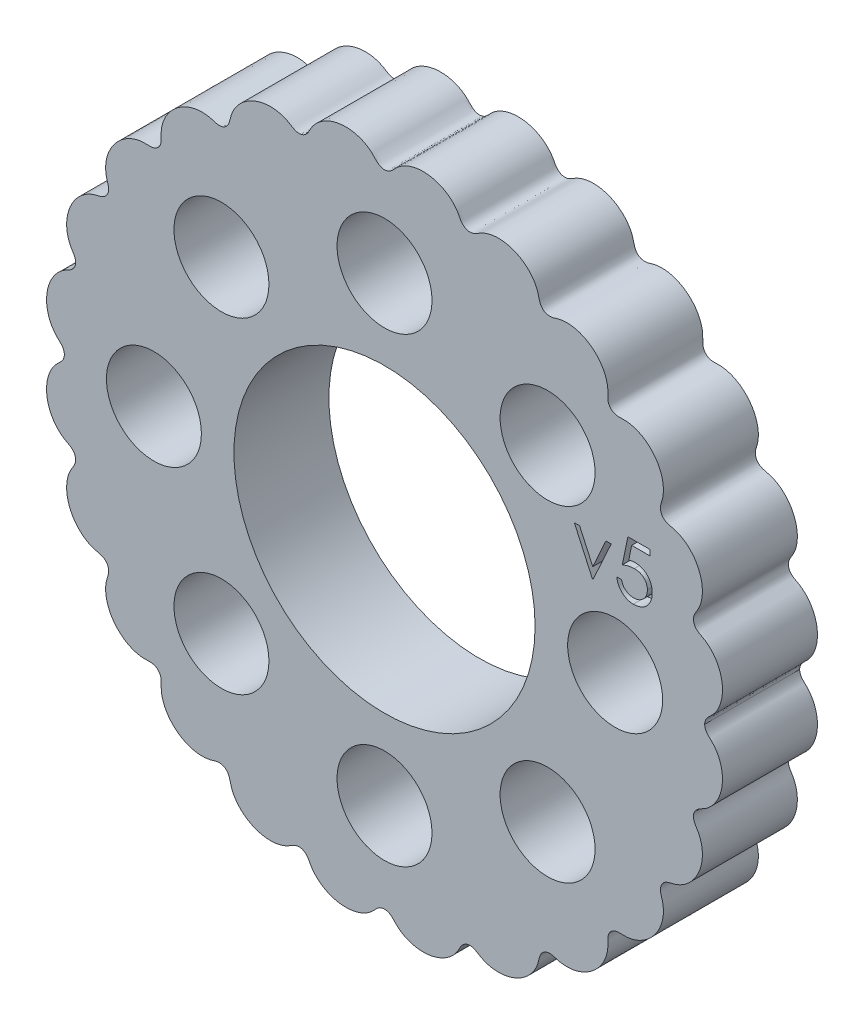
from build123d import *

# Parameters (mm, degrees)
BOSS_EXTRU_1_DEPTH      = 7
ESQUISSE2_R             = 11.1
ESQUISSE2_R_2           = 3.5
ENL_V_MAT_EXTRU_1_DEPTH = 36.920734554
VERSION_TEXT_DEPTH      = 1


with BuildPart() as part:
    # Esquisse1 → Boss.-Extru.1 (new body)
    with BuildSketch(Plane.XY):
        with BuildLine():
            add(Edge.make_bspline(
                [(23.6, 0), (23.6, 0.141263317), (23.694957489, 0.436529968), (23.984105148, 0.699966416), (24.214098656, 0.92210788), (24.485922993, 1.265914284), (24.738195558, 1.753151116), (24.902804155, 2.39533748), (24.929061691, 3.058471588), (24.820146126, 3.713569854), (24.57955061, 4.33187121), (24.214467979, 4.883674944), (23.809838813, 5.256722709), (23.444567676, 5.486205657), (23.121830867, 5.632182108), (22.805829464, 5.950444407), (22.734313606, 6.404992853), (22.914932417, 6.792042139), (23.100388311, 7.061569454), (23.241322807, 7.357836955), (23.379653116, 7.771179165), (23.455167998, 8.317175234), (23.400481311, 8.977844215), (23.210210839, 9.613984821), (22.894930523, 10.198352072), (22.466428325, 10.704182585), (22.026991864, 11.036841208), (21.636830993, 11.231351768), (21.327761788, 11.341047304), (21.006646284, 11.400550336), (20.604652425, 11.546398108), (20.33360552, 11.919233538), (20.332098964, 12.366005113), (20.45722004, 12.699209104), (20.553070598, 13.118610088), (20.575521706, 13.669103022), (20.443453625, 14.317226653), (20.176384255, 14.92460977), (19.790172286, 15.464839232), (19.30269971, 15.915187436), (18.732196788, 16.252890186), (18.209304306, 16.419015566), (17.773926091, 16.469947133), (17.454880581, 16.46414596), (17.062370957, 16.447336106), (16.654155245, 16.654181217), (16.447354302, 17.062303221), (16.463995345, 17.454871193), (16.47000351, 17.773792082), (16.418987054, 18.209391085), (16.252899593, 18.732164041), (15.915186599, 19.302700185), (15.464853958, 19.790162793), (14.924615452, 20.176378936), (14.317280714, 20.443456307), (13.668954873, 20.575502528), (13.119018963, 20.55312993), (12.698551766, 20.457182646), (12.366975365, 20.332173557), (11.918544843, 20.333761346), (11.546613574, 20.604610058), (11.40064872, 21.005766845), (11.341293082, 21.327714877), (11.231226117, 21.63694), (11.036938401, 22.026913374), (10.704156075, 22.466459205), (10.198341832, 22.894933668), (9.613976893, 23.210215116), (8.977833581, 23.400481614), (8.317182897, 23.455167864), (7.771097903, 23.379662569), (7.357907338, 23.241306143), (7.061498599, 23.100444819), (6.791854452, 22.914860356), (6.404942564, 22.734347878), (5.950451983, 22.805835984), (5.632237823, 23.121749776), (5.486345168, 23.444347145), (5.256676854, 23.809987802), (4.883690774, 24.214428605), (4.331849996, 24.5795686), (3.713564416, 24.820144223), (3.058466294, 24.929064174), (2.395320656, 24.902799203), (1.753142261, 24.73820842), (1.265895934, 24.485857583), (0.922135884, 24.214172246), (0.700203774, 23.984231078), (0.434473803, 23.694819976), (5.2772e-05, 23.552557421), (-0.434333113, 23.694820917), (-0.701425566, 23.984569), (-0.921337471, 24.213735069), (-1.266478689, 24.486196796), (-1.752999049, 24.738117012), (-2.395391205, 24.902832375), (-3.058454415, 24.929057732), (-3.713563151, 24.82014516), (-4.331853239, 24.579567427), (-4.883691331, 24.214428226), (-5.256677903, 23.809987443), (-5.4863451, 23.44434672), (-5.632237756, 23.12174991), (-5.950451972, 22.805835957), (-6.404942594, 22.734347884), (-6.791854452, 22.914860344), (-7.061498587, 23.100444822), (-7.357907347, 23.241306142), (-7.771097896, 23.37966257), (-8.317182899, 23.455167864), (-8.977833581, 23.400481614), (-9.613976894, 23.210215116), (-10.198341833, 22.894933668), (-10.704156075, 22.466459205), (-11.036938403, 22.026913373), (-11.231226116, 21.636940001), (-11.341293084, 21.327714875), (-11.400648718, 21.005766845), (-11.546613572, 20.60461006), (-11.918544844, 20.333761347), (-12.366975388, 20.332173538), (-12.698551664, 20.457182667), (-13.119019113, 20.553129909), (-13.668955007, 20.575502444), (-14.31728076, 20.443456275), (-14.924615464, 20.176378324), (-15.46485336, 19.790164133), (-15.915186091, 19.302700475), (-16.252900044, 18.732163975), (-16.418987453, 18.209390893), (-16.470003235, 17.773792163), (-16.463995514, 17.454871292), (-16.447354283, 17.062303151), (-16.654155252, 16.654181231), (-17.062370949, 16.447336105), (-17.454880537, 16.464145974), (-17.773926212, 16.469947179), (-18.209304238, 16.419015446), (-18.732196855, 16.252890081), (-19.302699499, 15.915187249), (-19.790172128, 15.464840391), (-20.1763834, 14.924609485), (-20.443455016, 14.317235113), (-20.575514472, 13.669078012), (-20.553095691, 13.118679577), (-20.457194791, 12.699092672), (-20.332084532, 12.366199531), (-20.33370059, 11.918980241), (-20.604412947, 11.54678832), (-21.006064592, 11.400694901), (-21.327826085, 11.341205229), (-21.636901956, 11.231235101), (-22.026915175, 11.03694368), (-22.46644734, 10.70416594), (-22.894929089, 10.198350592), (-23.210211743, 9.613983535), (-23.400479411, 8.977847773), (-23.455168277, 8.317175145), (-23.379653689, 7.771179811), (-23.241322407, 7.357836312), (-23.10038839, 7.061570012), (-22.914932508, 6.79204212), (-22.734313593, 6.404992849), (-22.805829472, 5.9504444), (-23.121830856, 5.632182119), (-23.444567687, 5.486205649), (-23.809838801, 5.256722717), (-24.214467983, 4.88367495), (-24.57955057, 4.331871224), (-24.820146163, 3.713569956), (-24.929061366, 3.058471564), (-24.90280557, 2.395337789), (-24.738191624, 1.753148162), (-24.485935157, 1.265916949), (-24.21407506, 0.922091043), (-23.984176287, 0.70007175), (-23.694816972, 0.436329885), (-23.6, 0.141221691), (-23.6, 0)],
                knots=[0.075303121, 0.075303121, 0.075303121, 0.075303121, 0.078621066, 0.081939011, 0.085256955, 0.0885749, 0.095210789, 0.101846679, 0.108482568, 0.115118457, 0.121754346, 0.128390236, 0.135026125, 0.13834407, 0.141662014, 0.144979959, 0.148297904, 0.151615848, 0.154933793, 0.158251737, 0.161569682, 0.168205571, 0.174841461, 0.18147735, 0.188113239, 0.194749129, 0.201385018, 0.204702962, 0.208020907, 0.211338852, 0.214656796, 0.217974741, 0.221292686, 0.22461063, 0.227928575, 0.234564464, 0.241200354, 0.247836243, 0.254472132, 0.261108021, 0.267743911, 0.2743798, 0.277697745, 0.281015689, 0.284333634, 0.287651579, 0.290969523, 0.294287468, 0.297605412, 0.300923357, 0.307559246, 0.314195136, 0.320831025, 0.327466914, 0.334102804, 0.340738693, 0.347374582, 0.350692527, 0.354010471, 0.357328416, 0.360646361, 0.363964305, 0.36728225, 0.370600195, 0.373918139, 0.380554029, 0.387189918, 0.393825807, 0.400461696, 0.407097586, 0.413733475, 0.41705142, 0.420369364, 0.423687309, 0.427005254, 0.430323198, 0.433641143, 0.436959087, 0.440277032, 0.446912921, 0.453548811, 0.4601847, 0.466820589, 0.473456478, 0.480092368, 0.486728257, 0.490046202, 0.493364146, 0.496682091, 0.500000036, 0.50331798, 0.506635925, 0.50995387, 0.513271814, 0.519907703, 0.526543593, 0.533179482, 0.539815371, 0.546451261, 0.55308715, 0.559723039, 0.563040984, 0.566358928, 0.569676873, 0.572994818, 0.576312762, 0.579630707, 0.582948652, 0.586266596, 0.592902486, 0.599538375, 0.606174264, 0.612810153, 0.619446043, 0.626081932, 0.629399877, 0.632717821, 0.636035766, 0.639353711, 0.642671655, 0.6459896, 0.649307545, 0.652625489, 0.659261378, 0.665897268, 0.672533157, 0.679169046, 0.685804936, 0.692440825, 0.699076714, 0.702394659, 0.705712603, 0.709030548, 0.712348493, 0.715666437, 0.718984382, 0.722302327, 0.725620271, 0.732256161, 0.73889205, 0.745527939, 0.752163828, 0.758799718, 0.765435607, 0.772071496, 0.775389441, 0.778707386, 0.78202533, 0.785343275, 0.78866122, 0.791979164, 0.795297109, 0.798615053, 0.805250943, 0.811886832, 0.818522721, 0.825158611, 0.8317945, 0.838430389, 0.841748334, 0.845066278, 0.848384223, 0.851702168, 0.855020112, 0.858338057, 0.861656002, 0.864973946, 0.871609836, 0.878245725, 0.884881614, 0.891517503, 0.898153393, 0.904789282, 0.911425171, 0.914743116, 0.918061061, 0.921379005, 0.92469695, 0.92469695, 0.92469695, 0.92469695], degree=3))
            add(Edge.make_bspline(
                [(-23.6, 0), (-23.6, -0.141221691), (-23.694816972, -0.436329885), (-23.984176287, -0.70007175), (-24.21407506, -0.922091043), (-24.485935157, -1.265916949), (-24.738191624, -1.753148162), (-24.90280557, -2.395337789), (-24.929061366, -3.058471564), (-24.820146163, -3.713569956), (-24.57955057, -4.331871224), (-24.214467983, -4.88367495), (-23.809838801, -5.256722717), (-23.444567687, -5.486205649), (-23.121830856, -5.632182119), (-22.805829472, -5.9504444), (-22.734313593, -6.404992849), (-22.914932508, -6.79204212), (-23.10038839, -7.061570012), (-23.241322407, -7.357836312), (-23.379653689, -7.771179811), (-23.455168277, -8.317175145), (-23.400479411, -8.977847773), (-23.210211743, -9.613983535), (-22.894929089, -10.198350592), (-22.46644734, -10.70416594), (-22.026915175, -11.03694368), (-21.636901956, -11.231235101), (-21.327826085, -11.341205229), (-21.006064592, -11.400694901), (-20.604412947, -11.54678832), (-20.33370059, -11.918980241), (-20.332084532, -12.366199531), (-20.457194791, -12.699092672), (-20.553095691, -13.118679577), (-20.575514472, -13.669078012), (-20.443455016, -14.317235113), (-20.1763834, -14.924609485), (-19.790172128, -15.464840391), (-19.302699499, -15.915187249), (-18.732196855, -16.252890081), (-18.209304238, -16.419015446), (-17.773926212, -16.469947179), (-17.454880537, -16.464145974), (-17.062370949, -16.447336105), (-16.654155252, -16.654181231), (-16.447354283, -17.062303151), (-16.463995514, -17.454871292), (-16.470003235, -17.773792163), (-16.418987453, -18.209390893), (-16.252900044, -18.732163975), (-15.915186091, -19.302700475), (-15.46485336, -19.790164133), (-14.924615464, -20.176378324), (-14.31728076, -20.443456275), (-13.668955007, -20.575502444), (-13.119019113, -20.553129909), (-12.698551664, -20.457182667), (-12.366975388, -20.332173538), (-11.918544844, -20.333761347), (-11.546613572, -20.60461006), (-11.400648718, -21.005766845), (-11.341293084, -21.327714875), (-11.231226116, -21.636940001), (-11.036938403, -22.026913373), (-10.704156075, -22.466459205), (-10.198341833, -22.894933668), (-9.613976894, -23.210215116), (-8.977833581, -23.400481614), (-8.317182899, -23.455167864), (-7.771097896, -23.37966257), (-7.357907347, -23.241306142), (-7.061498587, -23.100444822), (-6.791854452, -22.914860344), (-6.404942594, -22.734347884), (-5.950451972, -22.805835957), (-5.632237756, -23.12174991), (-5.4863451, -23.44434672), (-5.256677903, -23.809987443), (-4.883691331, -24.214428226), (-4.331853239, -24.579567427), (-3.713563151, -24.82014516), (-3.058454415, -24.929057732), (-2.395391205, -24.902832375), (-1.752999049, -24.738117012), (-1.266478689, -24.486196796), (-0.921337471, -24.213735069), (-0.701425566, -23.984569), (-0.434333113, -23.694820917), (5.2772e-05, -23.552557421), (0.434473803, -23.694819976), (0.700203774, -23.984231078), (0.922135884, -24.214172246), (1.265895934, -24.485857583), (1.753142261, -24.73820842), (2.395320656, -24.902799203), (3.058466294, -24.929064174), (3.713564416, -24.820144223), (4.331849996, -24.5795686), (4.883690774, -24.214428605), (5.256676854, -23.809987802), (5.486345168, -23.444347145), (5.632237823, -23.121749776), (5.950451983, -22.805835984), (6.404942564, -22.734347878), (6.791854452, -22.914860356), (7.061498599, -23.100444819), (7.357907338, -23.241306143), (7.771097903, -23.379662569), (8.317182897, -23.455167864), (8.977833581, -23.400481614), (9.613976893, -23.210215116), (10.198341832, -22.894933668), (10.704156075, -22.466459205), (11.036938401, -22.026913374), (11.231226117, -21.63694), (11.341293082, -21.327714877), (11.40064872, -21.005766845), (11.546613574, -20.604610058), (11.918544843, -20.333761346), (12.366975365, -20.332173557), (12.698551766, -20.457182646), (13.119018963, -20.55312993), (13.668954873, -20.575502528), (14.317280714, -20.443456307), (14.924615452, -20.176378936), (15.464853958, -19.790162793), (15.915186599, -19.302700185), (16.252899593, -18.732164041), (16.418987054, -18.209391085), (16.47000351, -17.773792082), (16.463995345, -17.454871193), (16.447354302, -17.062303221), (16.654155245, -16.654181217), (17.062370957, -16.447336106), (17.454880581, -16.46414596), (17.773926091, -16.469947133), (18.209304306, -16.419015566), (18.732196788, -16.252890186), (19.30269971, -15.915187436), (19.790172286, -15.464839232), (20.176384255, -14.92460977), (20.443453625, -14.317226653), (20.575521706, -13.669103022), (20.553070598, -13.118610088), (20.45722004, -12.699209104), (20.332098964, -12.366005113), (20.33360552, -11.919233538), (20.604652425, -11.546398108), (21.006646284, -11.400550336), (21.327761788, -11.341047304), (21.636830993, -11.231351768), (22.026991864, -11.036841208), (22.466428325, -10.704182585), (22.894930523, -10.198352072), (23.210210839, -9.613984821), (23.400481311, -8.977844215), (23.455167998, -8.317175234), (23.379653116, -7.771179165), (23.241322807, -7.357836955), (23.100388311, -7.061569454), (22.914932417, -6.792042139), (22.734313606, -6.404992853), (22.805829464, -5.950444407), (23.121830867, -5.632182108), (23.444567676, -5.486205657), (23.809838813, -5.256722709), (24.214467979, -4.883674944), (24.57955061, -4.33187121), (24.820146126, -3.713569854), (24.929061691, -3.058471588), (24.902804155, -2.39533748), (24.738195558, -1.753151116), (24.485922993, -1.265914284), (24.214098656, -0.92210788), (23.984105148, -0.699966416), (23.694957489, -0.436529968), (23.6, -0.141263317), (23.6, 0)],
                knots=[0.075303121, 0.075303121, 0.075303121, 0.075303121, 0.078621066, 0.081939011, 0.085256955, 0.0885749, 0.095210789, 0.101846679, 0.108482568, 0.115118457, 0.121754346, 0.128390236, 0.135026125, 0.13834407, 0.141662014, 0.144979959, 0.148297904, 0.151615848, 0.154933793, 0.158251737, 0.161569682, 0.168205571, 0.174841461, 0.18147735, 0.188113239, 0.194749129, 0.201385018, 0.204702962, 0.208020907, 0.211338852, 0.214656796, 0.217974741, 0.221292686, 0.22461063, 0.227928575, 0.234564464, 0.241200354, 0.247836243, 0.254472132, 0.261108021, 0.267743911, 0.2743798, 0.277697745, 0.281015689, 0.284333634, 0.287651579, 0.290969523, 0.294287468, 0.297605412, 0.300923357, 0.307559246, 0.314195136, 0.320831025, 0.327466914, 0.334102804, 0.340738693, 0.347374582, 0.350692527, 0.354010471, 0.357328416, 0.360646361, 0.363964305, 0.36728225, 0.370600195, 0.373918139, 0.380554029, 0.387189918, 0.393825807, 0.400461696, 0.407097586, 0.413733475, 0.41705142, 0.420369364, 0.423687309, 0.427005254, 0.430323198, 0.433641143, 0.436959087, 0.440277032, 0.446912921, 0.453548811, 0.4601847, 0.466820589, 0.473456478, 0.480092368, 0.486728257, 0.490046202, 0.493364146, 0.496682091, 0.500000036, 0.50331798, 0.506635925, 0.50995387, 0.513271814, 0.519907703, 0.526543593, 0.533179482, 0.539815371, 0.546451261, 0.55308715, 0.559723039, 0.563040984, 0.566358928, 0.569676873, 0.572994818, 0.576312762, 0.579630707, 0.582948652, 0.586266596, 0.592902486, 0.599538375, 0.606174264, 0.612810153, 0.619446043, 0.626081932, 0.629399877, 0.632717821, 0.636035766, 0.639353711, 0.642671655, 0.6459896, 0.649307545, 0.652625489, 0.659261378, 0.665897268, 0.672533157, 0.679169046, 0.685804936, 0.692440825, 0.699076714, 0.702394659, 0.705712603, 0.709030548, 0.712348493, 0.715666437, 0.718984382, 0.722302327, 0.725620271, 0.732256161, 0.73889205, 0.745527939, 0.752163828, 0.758799718, 0.765435607, 0.772071496, 0.775389441, 0.778707386, 0.78202533, 0.785343275, 0.78866122, 0.791979164, 0.795297109, 0.798615053, 0.805250943, 0.811886832, 0.818522721, 0.825158611, 0.8317945, 0.838430389, 0.841748334, 0.845066278, 0.848384223, 0.851702168, 0.855020112, 0.858338057, 0.861656002, 0.864973946, 0.871609836, 0.878245725, 0.884881614, 0.891517503, 0.898153393, 0.904789282, 0.911425171, 0.914743116, 0.918061061, 0.921379005, 0.92469695, 0.92469695, 0.92469695, 0.92469695], degree=3))
        make_face()
    extrude(amount=BOSS_EXTRU_1_DEPTH)

    # Esquisse2 → Enlèv. mat.-Extru.1 (cut, through all)
    with BuildSketch(Plane.XY.offset(7)):
        Circle(ESQUISSE2_R)
        with Locations((0, 17)):
            Circle(ESQUISSE2_R_2)
        with Locations((12.02081528, 12.02081528)):
            Circle(ESQUISSE2_R_2)
        with Locations((17, 0)):
            Circle(ESQUISSE2_R_2)
        with Locations((12.02081528, -12.02081528)):
            Circle(ESQUISSE2_R_2)
        with Locations((0, -17)):
            Circle(ESQUISSE2_R_2)
        with Locations((-12.02081528, -12.02081528)):
            Circle(ESQUISSE2_R_2)
        with Locations((-17, 0)):
            Circle(ESQUISSE2_R_2)
        with Locations((-12.02081528, 12.02081528)):
            Circle(ESQUISSE2_R_2)
    extrude(amount=-ENL_V_MAT_EXTRU_1_DEPTH, mode=Mode.SUBTRACT)

    # Esquisse3 → Version Text (cut)
    with BuildSketch(Plane.XY.offset(7)):
        Polygon((13.99216841, 8.066161521), (14.380790205, 8.066161521), (15.351142769, 5.937956392), (16.321495333, 8.066161521), (16.710117128, 8.066161521), (15.376783794, 5.143084598), (15.325501743, 5.143084598), align=None)
        with BuildLine():
            Line((19.581911999, 9.143084598), (19.581911999, 8.732828187))
            Line((19.581911999, 8.732828187), (18.221335076, 8.732828187))
            Line((18.221335076, 8.732828187), (18.005790205, 7.680744854))
            add(Edge.make_bspline(
                [(18.005790205, 7.680744854), (18.048139775, 7.692436593), (18.13018537, 7.715087489), (18.251282354, 7.740236941), (18.366244873, 7.755397448), (18.440845296, 7.757467517), (18.476944051, 7.758469213)],
                knots=[0, 0, 0, 0, 1.100273476, 2.13160584, 3.095893838, 4, 4, 4, 4], degree=3))
            add(Edge.make_bspline(
                [(18.476944051, 7.758469213), (18.521611182, 7.757502429), (18.609437922, 7.755601491), (18.737939575, 7.737347949), (18.860605739, 7.708616618), (18.977179876, 7.668478879), (19.087877648, 7.617153469), (19.191680576, 7.553039252), (19.290146762, 7.478144016), (19.381509727, 7.392035431), (19.46439465, 7.297267869), (19.537270067, 7.195373159), (19.59917017, 7.087341545), (19.64895389, 6.97214085), (19.688707415, 6.851044674), (19.715166838, 6.722778866), (19.732785934, 6.588552443), (19.734754375, 6.496775791), (19.735758153, 6.449975623)],
                knots=[0, 0, 0, 0, 1.052922333, 2.070308379, 3.05430497, 4.020497103, 4.973039431, 5.925935799, 6.892292201, 7.88610001, 8.88166317, 9.857072816, 10.836096531, 11.812156883, 12.81219415, 13.836441305, 14.89672472, 16, 16, 16, 16], degree=3))
            add(Edge.make_bspline(
                [(19.735758153, 6.449975623), (19.734998067, 6.4173788), (19.733488167, 6.352625671), (19.725809781, 6.25646087), (19.711026106, 6.162331918), (19.691177278, 6.070226328), (19.665414515, 5.980318474), (19.634227025, 5.892351013), (19.596060136, 5.806871463), (19.554195707, 5.723071011), (19.507056875, 5.642844146), (19.454738581, 5.567816733), (19.399463734, 5.496863268), (19.339987865, 5.430744716), (19.275758156, 5.369895553), (19.20755248, 5.31395466), (19.135915087, 5.261975996), (19.059737667, 5.216069488), (18.980717686, 5.173826109), (18.897714009, 5.139170638), (18.812616066, 5.108187177), (18.724199065, 5.083490574), (18.63266328, 5.064139083), (18.537857822, 5.05099554), (18.440279913, 5.041422469), (18.374137042, 5.040823203), (18.340726102, 5.040520495)],
                knots=[0, 0, 0, 0, 1.056347294, 2.098418968, 3.122841568, 4.141288669, 5.149314143, 6.15115421, 7.162517403, 8.180376062, 9.185164535, 10.17417709, 11.141909838, 12.097768115, 13.052685741, 14.0056014, 14.954263652, 15.917497458, 16.885230207, 17.854509472, 18.828990115, 19.81800267, 20.826176721, 21.857883937, 22.917946725, 24, 24, 24, 24], degree=3))
            add(Edge.make_bspline(
                [(18.340726102, 5.040520495), (18.300869895, 5.041310024), (18.222457518, 5.042863329), (18.107576869, 5.059113027), (17.997045892, 5.082386074), (17.891754347, 5.117398954), (17.790758617, 5.161270148), (17.695418368, 5.216717201), (17.603297482, 5.279550462), (17.518140868, 5.353699437), (17.43910531, 5.434745931), (17.368355014, 5.522697521), (17.305345212, 5.616102598), (17.25108493, 5.715414774), (17.204801477, 5.820373095), (17.16844149, 5.93137081), (17.139094799, 6.047827957), (17.126679461, 6.128003398), (17.120373538, 6.168725623)],
                knots=[0, 0, 0, 0, 1.0467383, 2.05933395, 3.04377827, 4.011590433, 4.970194871, 5.932262533, 6.905835911, 7.896367577, 8.894135286, 9.877477877, 10.858688626, 11.851381753, 12.8477658, 13.868841284, 14.917554742, 16, 16, 16, 16], degree=3))
            Line((17.120373538, 6.168725623), (17.479347897, 6.168725623))
            add(Edge.make_bspline(
                [(17.479347897, 6.168725623), (17.488180534, 6.130581106), (17.505157353, 6.057265226), (17.542421066, 5.954257979), (17.587982066, 5.86246458), (17.642158464, 5.780670771), (17.706787071, 5.709346203), (17.780534989, 5.645783846), (17.863218102, 5.588440841), (17.955096078, 5.540643393), (18.052025312, 5.499879103), (18.153473552, 5.472734309), (18.256678519, 5.453647575), (18.326482371, 5.451736991), (18.361559435, 5.450776905)],
                knots=[0, 0, 0, 0, 1.136247022, 2.183929868, 3.172523383, 4.106158343, 5.02341133, 5.958108904, 6.928429099, 7.938127109, 8.96079061, 9.975095812, 10.982467395, 12, 12, 12, 12], degree=3))
            add(Edge.make_bspline(
                [(18.361559435, 5.450776905), (18.395797658, 5.451714937), (18.463212997, 5.45356193), (18.562426011, 5.467777943), (18.658212152, 5.489672311), (18.749626274, 5.522437859), (18.838268034, 5.562260394), (18.9218952, 5.613363338), (19.00292706, 5.672174788), (19.078844927, 5.739553794), (19.148375726, 5.813804873), (19.209811293, 5.893207609), (19.260984908, 5.977912576), (19.304109604, 6.066453322), (19.336856231, 6.159800245), (19.360217353, 6.257515873), (19.373935134, 6.359841565), (19.375822197, 6.429635062), (19.376783794, 6.465199982)],
                knots=[0, 0, 0, 0, 1.027316725, 2.022795036, 3.002884548, 3.971462791, 4.93288096, 5.914575861, 6.907176829, 7.935150275, 8.956128384, 9.956726525, 10.942570165, 11.921478529, 12.907843606, 13.90538589, 14.932640048, 16, 16, 16, 16], degree=3))
            add(Edge.make_bspline(
                [(19.376783794, 6.465199982), (19.376031246, 6.497286555), (19.374558241, 6.560091457), (19.362523303, 6.651976265), (19.341589621, 6.738916884), (19.312533758, 6.821333152), (19.275642892, 6.8993028), (19.230561392, 6.972906297), (19.176443223, 7.041173535), (19.114623922, 7.104136454), (19.046900446, 7.162244882), (18.972107598, 7.211780981), (18.891810538, 7.25345403), (18.806976711, 7.289417457), (18.715588255, 7.31524688), (18.619454961, 7.334638749), (18.517538723, 7.345856306), (18.447857937, 7.34741275), (18.412040205, 7.348212803)],
                knots=[0, 0, 0, 0, 1.045622112, 2.046656509, 3.013763289, 3.955457236, 4.890082067, 5.820317437, 6.762574623, 7.722996705, 8.69280354, 9.665887285, 10.63943826, 11.638615906, 12.663482002, 13.728887084, 14.832589034, 16, 16, 16, 16], degree=3))
            add(Edge.make_bspline(
                [(18.412040205, 7.348212803), (18.381035714, 7.34754927), (18.317019308, 7.346179243), (18.218821792, 7.336091818), (18.115631252, 7.319818339), (18.007843257, 7.297434056), (17.895134105, 7.268141397), (17.777741647, 7.23303911), (17.655419056, 7.191071112), (17.5729988, 7.159377153), (17.530629948, 7.143084598)],
                knots=[0, 0, 0, 0, 0.817624296, 1.688186739, 2.600797293, 3.572016777, 4.590301741, 5.671205678, 6.80286297, 8, 8, 8, 8], degree=3))
            Line((17.530629948, 7.143084598), (17.940886358, 9.143084598))
            Line((17.940886358, 9.143084598), (19.581911999, 9.143084598))
        make_face()
    extrude(amount=-VERSION_TEXT_DEPTH, mode=Mode.SUBTRACT)


solid = part.part
